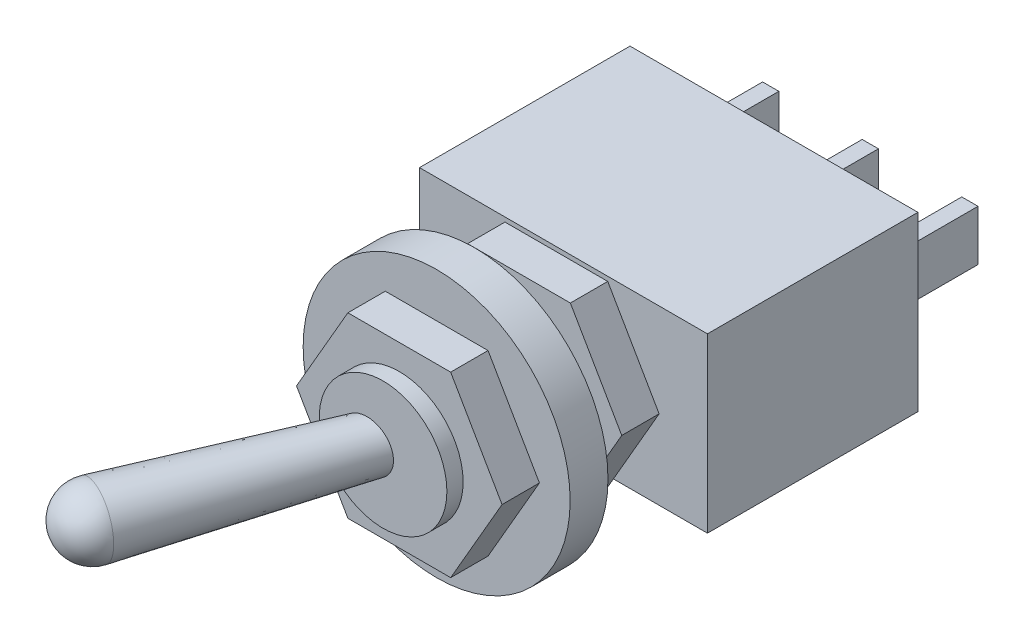
from build123d import *

# Parameters (mm, degrees)
SKETCH1_W           = 12.94
SKETCH1_H           = 7.76
BOSS_EXTRUDE1_DEPTH = 9.46
SKETCH2_R           = 2.87
BOSS_EXTRUDE2_DEPTH = 8.11
SKETCH4_W           = 0.73
SKETCH4_H           = 2.27
BOSS_EXTRUDE3_DEPTH = 4.33
BOSS_EXTRUDE4_DEPTH = 1.68
SKETCH6_R           = 6
BOSS_EXTRUDE5_DEPTH = 1.7
BOSS_EXTRUDE6_DEPTH = 1.68


with BuildPart() as part:
    # Sketch1 → Boss-Extrude1 (new body)
    with BuildSketch(Plane.XY):
        Rectangle(SKETCH1_W, SKETCH1_H)
    extrude(amount=BOSS_EXTRUDE1_DEPTH)

    # Sketch2 → Boss-Extrude2 (add)
    with BuildSketch(Plane.XY.offset(9.46)):
        Circle(SKETCH2_R)
    extrude(amount=BOSS_EXTRUDE2_DEPTH)

    # Sketch3 → Revolve1 (revolve)
    with BuildSketch(Plane(origin=(0, 0, 0), x_dir=(1, 0, 0), z_dir=(0, 1, 0))):
        with BuildLine():
            Line((0.46866366, -17.57), (-2.564053278, -27.111612822))
            ThreePointArc((-2.564053278, -27.111612822), (-3.316297804, -27.98726181), (-4.468815416, -28.053111116))
            Line((-4.468815416, -28.053111116), (-0.702418437, -17.57))
            Line((-0.702418437, -17.57), (0.46866366, -17.57))
        make_face()
    revolve(axis=Axis((-4.468815416, 0, 28.053111116), (0.3381215193488044, 0, -0.9411024589029912)))

    # Sketch4 → Boss-Extrude3 (add)
    with BuildSketch(Plane(origin=(0, 0, 0), x_dir=(-1, 0, 0), z_dir=(0, 0, -1))):
        Rectangle(SKETCH4_W, SKETCH4_H)
        with Locations((-4.475, 0)):
            Rectangle(SKETCH4_W, SKETCH4_H)
        with Locations((4.475, 0)):
            Rectangle(SKETCH4_W, SKETCH4_H)
    extrude(amount=BOSS_EXTRUDE3_DEPTH)

    # Sketch5 → Boss-Extrude4 (add)
    with BuildSketch(Plane.XY.offset(11.46)):
        Polygon((-2.309401077, -4), (2.309401077, -4), (4.618802154, 0), (2.309401077, 4), (-2.309401077, 4), (-4.618802154, 0), align=None)
    extrude(amount=-BOSS_EXTRUDE4_DEPTH)

    # Sketch6 → Boss-Extrude5 (add)
    with BuildSketch(Plane.XY.offset(13.46)):
        Circle(SKETCH6_R)
    extrude(amount=BOSS_EXTRUDE5_DEPTH)

    # Sketch7 → Boss-Extrude6 (add)
    with BuildSketch(Plane.XY.offset(15.16)):
        Polygon((-2.309401077, -4), (2.309401077, -4), (4.618802154, 0), (2.309401077, 4), (-2.309401077, 4), (-4.618802154, 0), align=None)
    extrude(amount=BOSS_EXTRUDE6_DEPTH)


solid = part.part
